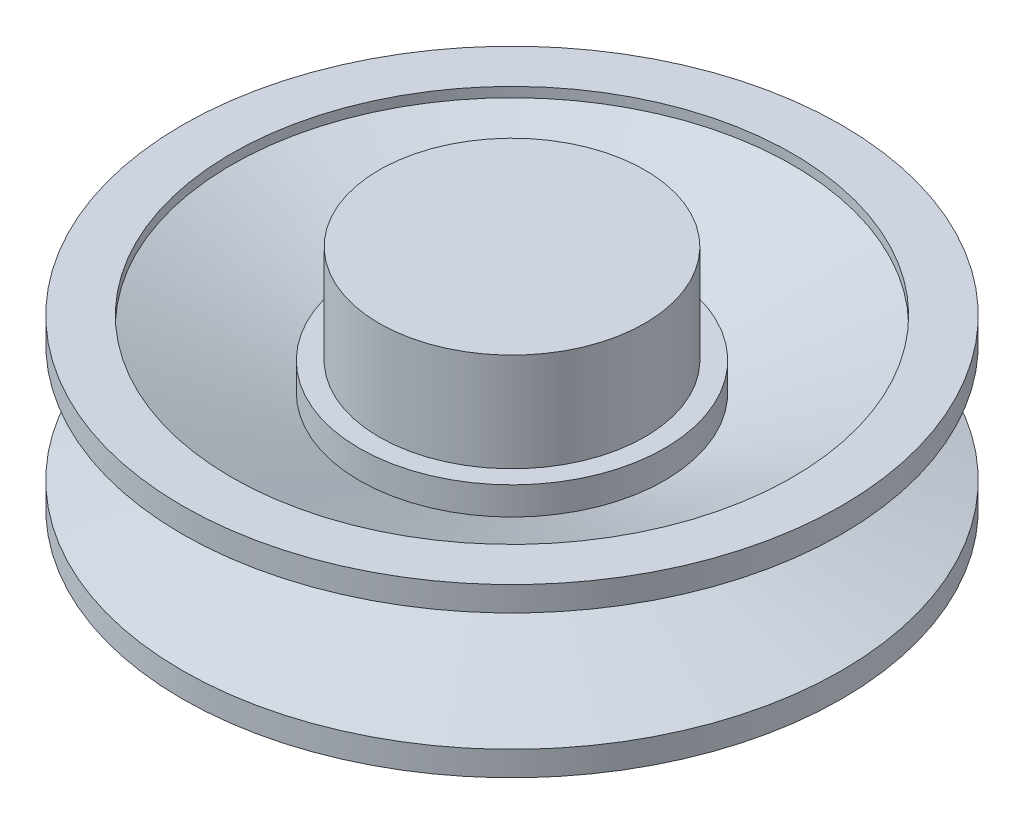
from build123d import *


with BuildPart() as part:
    # Sketch4 → Revolve1 (revolve)
    with BuildSketch(Plane(origin=(0, 0, 0), x_dir=(0, 0, -1), z_dir=(1, 0, 0))):
        Polygon((0, 25), (0, -25), (-31, -25), (-31, -11.639049179), (-57, -19.096481272), (-57, -21.096481272), (-67, -21.096481272), (-67, -16.096481272), (-42, -8.92587349), (-42, -3.225013879), (-67, 7.903518728), (-67, 12.903518728), (-57, 12.903518728), (-57, 10.903518728), (-31, -0.670155183), (-31, 5), (-27, 5), (-27, 25), align=None)
    revolve(axis=Axis((0, 25, 0), (0, -1, 0)))


solid = part.part
